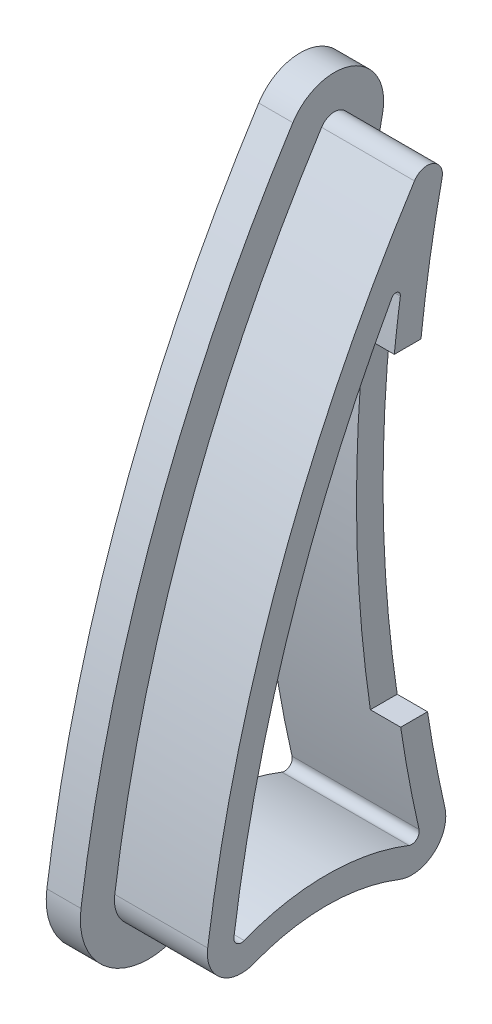
from build123d import *

# Parameters (mm, degrees)
BOSS_EXTRUDE1_DEPTH = 76.2
SKETCH2_W           = 6.985
SKETCH2_H           = 9.525
CUT_EXTRUDE1_DEPTH  = 119.84173867
CUT_EXTRUDE2_DEPTH  = 119.84173867
CUT_EXTRUDE3_DEPTH  = 119.84173867
CUT_EXTRUDE4_DEPTH  = 5.08
CUT_EXTRUDE6_DEPTH  = 36.83
FILLET2_R           = 0.762
BOSS_EXTRUDE2_DEPTH = 15.5575
FILLET3_R           = 0.762
BOSS_EXTRUDE3_DEPTH = 5.715
CUT_EXTRUDE7_START  = 5.08
CUT_EXTRUDE7_DEPTH  = 5.08


with BuildPart() as part:
    # Sketch1 → Boss-Extrude1 (new body)
    with BuildSketch(Plane.XY):
        Polygon((-15.5575, 76.2), (15.5575, 76.2), (15.5575, -76.2), (7.845485509, -76.2), (9.525, -85.725), (-9.525, -85.725), (-7.845485509, -76.2), (-15.5575, -76.2), align=None)
    extrude(amount=BOSS_EXTRUDE1_DEPTH)

    # Sketch2 → Cut-Extrude1 (cut, through all)
    with BuildSketch(Plane(origin=(15.5575, 0, 0), x_dir=(0, 0, -1), z_dir=(1, 0, 0))):
        with Locations((-3.4925, -80.9625)):
            Rectangle(SKETCH2_W, SKETCH2_H)
    extrude(amount=-CUT_EXTRUDE1_DEPTH, mode=Mode.SUBTRACT)

    # Sketch3 → Cut-Extrude2 (cut, through all)
    with BuildSketch(Plane(origin=(15.5575, 0, 0), x_dir=(0, 0, -1), z_dir=(1, 0, 0))):
        with BuildLine():
            Line((-76.2, -85.725), (-76.2, -76.2))
            Line((-76.2, -76.2), (-76.2, 76.2))
            Line((-76.2, 76.2), (-15.907508532, 76.2))
            ThreePointArc((-15.907508532, 76.2), (-60.637785123, 0.667838465), (-76.2, -85.725))
        make_face()
        with BuildLine():
            Line((0, -76.2), (0, 63.796446855))
            ThreePointArc((0, 63.796446855), (-12.85182234, -6.201776572), (0, -76.2))
        make_face()
    extrude(amount=-CUT_EXTRUDE2_DEPTH, mode=Mode.SUBTRACT)

    # Sketch6 → Cut-Extrude3 (cut, through all)
    with BuildSketch(Plane(origin=(15.5575, 0, 0), x_dir=(0, 0, -1), z_dir=(1, 0, 0))):
        with BuildLine():
            ThreePointArc((-26.004408293, 40.411420838), (-22.895186728, 41.391641282), (-21.382101704, 38.503966686))
            ThreePointArc((-21.382101704, 38.503966686), (-26.183938112, -7.303408092), (-20.902654077, -53.057984431))
            ThreePointArc((-20.902654077, -53.057984431), (-22.751384732, -58.666992363), (-28.575599954, -59.645405394))
            ThreePointArc((-28.575599954, -59.645405394), (-40.728748793, -57.329846812), (-52.881897632, -59.645405394))
            ThreePointArc((-52.881897632, -59.645405394), (-58.514495406, -58.82440967), (-60.644203683, -53.545722871))
            ThreePointArc((-60.644203683, -53.545722871), (-48.403726567, -4.694487773), (-26.004408293, 40.411420838))
        make_face()
    extrude(amount=-CUT_EXTRUDE3_DEPTH, mode=Mode.SUBTRACT)

    # Sketch7 → Cut-Extrude4 (cut, symmetric)
    with BuildSketch(Plane(origin=(0, 0, 0), x_dir=(0, 0, -1), z_dir=(1, 0, 0))):
        with BuildLine():
            Line((-24.910956945, 16.933040929), (-11.489033389, 16.933040929))
            ThreePointArc((-11.489033389, 16.933040929), (-12.80682615, -10.412600109), (-10.321792572, -37.676959071))
            Line((-10.321792572, -37.676959071), (-23.81904356, -37.676959071))
            ThreePointArc((-23.81904356, -37.676959071), (-26.144779891, -10.407545323), (-24.910956945, 16.933040929))
        make_face()
    extrude(amount=CUT_EXTRUDE4_DEPTH, both=True, mode=Mode.SUBTRACT)

    # Sketch10 → Cut-Extrude6 (cut, symmetric)
    with BuildSketch(Plane(origin=(15.5575, 76.2, 15.907508532), x_dir=(-1, 0, 0), z_dir=(0, -0.6148991463064188, -0.7886057569353888))):
        Polygon((0, 9.781513416), (8.255, 9.781513416), (0, -2.283486584), align=None)
        Polygon((31.115, 9.781513416), (31.115, -2.283486584), (22.86, 9.781513416), align=None)
    extrude(amount=CUT_EXTRUDE6_DEPTH, both=True, mode=Mode.SUBTRACT)

    # Fillet2
    fillet2_edges = [part.edges().sort_by_distance(p)[0] for p in [
        (-15.5575, 4.051612744, 59.349592349),
        (-14.77625063, 75.333628159, 16.653053168),
        (0, 76.2, 15.907508532),
        (15.5575, 4.051612744, 59.349592349),
        (14.77625063, 75.333628159, 16.653053168),
    ]]
    fillet(fillet2_edges, radius=FILLET2_R)


with BuildPart() as body_2:
    # Sketch11 → Boss-Extrude2 (new body)
    with BuildSketch(Plane(origin=(15.5575, 0, 0), x_dir=(0, 0, -1), z_dir=(1, 0, 0))):
        with BuildLine():
            ThreePointArc((-60.644203683, -53.545722871), (-58.514495406, -58.82440967), (-52.881897632, -59.645405394))
            ThreePointArc((-52.881897632, -59.645405394), (-40.728748793, -57.329846812), (-28.575599954, -59.645405394))
            ThreePointArc((-28.575599954, -59.645405394), (-22.751384732, -58.666992363), (-20.902654077, -53.057984431))
            ThreePointArc((-20.902654077, -53.057984431), (-26.183938112, -7.303408092), (-21.382101704, 38.503966686))
            ThreePointArc((-21.382101704, 38.503966686), (-22.895186728, 41.391641282), (-26.004408293, 40.411420838))
            ThreePointArc((-26.004408293, 40.411420838), (-48.403726567, -4.694487773), (-60.644203683, -53.545722871))
        make_face()
        with BuildLine():
            ThreePointArc((-56.241344514, -54.156342338), (-55.768076008, -55.329383849), (-54.516387613, -55.511827344))
            ThreePointArc((-54.516387613, -55.511827344), (-40.728748793, -52.884846812), (-26.941109972, -55.511827344))
            ThreePointArc((-26.941109972, -55.511827344), (-25.646839923, -55.294402226), (-25.236010888, -54.047956018))
            ThreePointArc((-25.236010888, -54.047956018), (-30.535382276, -12.638178349), (-27.725713329, 29.014658098))
            ThreePointArc((-27.725713329, 29.014658098), (-45.998284717, -11.194361196), (-56.241344514, -54.156342338))
        make_face(mode=Mode.SUBTRACT)
    extrude(amount=-BOSS_EXTRUDE2_DEPTH)

    # Fillet3
    fillet3_edges = [body_2.edges().sort_by_distance(p)[0] for p in [
        (7.77875, 29.014658098, 27.725713329),
    ]]
    fillet(fillet3_edges, radius=FILLET3_R)

    # Sketch13 → Cut-Extrude7 (cut)
    with BuildSketch(Plane(origin=(0, 0, 0), x_dir=(0, 0, -1), z_dir=(1, 0, 0)).offset(CUT_EXTRUDE7_START)):
        with BuildLine():
            Line((-11.489033389, 16.933040929), (-29.382511575, 16.933040929))
            ThreePointArc((-29.382511575, 16.933040929), (-30.590678841, -10.406069442), (-28.313574796, -37.676959071))
            Line((-28.313574796, -37.676959071), (-10.321792572, -37.676959071))
            ThreePointArc((-10.321792572, -37.676959071), (-12.80682615, -10.412600109), (-11.489033389, 16.933040929))
        make_face()
    extrude(amount=-CUT_EXTRUDE7_DEPTH, mode=Mode.SUBTRACT)


with BuildPart() as body_3:
    # Sketch12 → Boss-Extrude3 (new body)
    with BuildSketch(Plane(origin=(15.5575, 0, 0), x_dir=(0, 0, -1), z_dir=(1, 0, 0))):
        with BuildLine():
            ThreePointArc((-30.820115457, 43.488788141), (-53.765912925, -2.717575417), (-66.305022615, -52.760640699))
            ThreePointArc((-66.305022615, -52.760640699), (-62.045606061, -63.318014297), (-50.780410512, -64.960005745))
            ThreePointArc((-50.780410512, -64.960005745), (-40.728748793, -63.044846812), (-30.677087073, -64.960005745))
            ThreePointArc((-30.677087073, -64.960005745), (-19.028656629, -63.003179683), (-15.331195319, -51.785163819))
            ThreePointArc((-15.331195319, -51.785163819), (-20.469016461, -7.273482937), (-15.797619041, 37.289562147))
            ThreePointArc((-15.797619041, 37.289562147), (-20.715145369, 46.674504585), (-30.820115457, 43.488788141))
        make_face()
        with BuildLine():
            ThreePointArc((-56.241344514, -54.156342338), (-55.768076008, -55.329383849), (-54.516387613, -55.511827344))
            ThreePointArc((-54.516387613, -55.511827344), (-40.728748793, -52.884846812), (-26.941109972, -55.511827344))
            ThreePointArc((-26.941109972, -55.511827344), (-25.646839923, -55.294402226), (-25.236010888, -54.047956018))
            ThreePointArc((-25.236010888, -54.047956018), (-30.462301973, -14.734514328), (-28.372972672, 24.869721798))
            ThreePointArc((-28.372972672, 24.869721798), (-28.883789244, 25.702089435), (-29.794040566, 25.34823638))
            ThreePointArc((-29.794040566, 25.34823638), (-46.671799333, -13.18850949), (-56.241344514, -54.156342338))
        make_face(mode=Mode.SUBTRACT)
    extrude(amount=BOSS_EXTRUDE3_DEPTH)


with BuildPart() as body_2_1:
    add(body_2.part)

    # Combine1: union body 3
    add(body_3.part)


with BuildPart() as body_2_2:
    # Mirror1: mirrored copy
    add(body_2_1.part.mirror(Plane(origin=(0, -70.027902522, -58.200215313), x_dir=(0, 0, 1), z_dir=(1, 0, 0))))


solid = body_2_2.part
